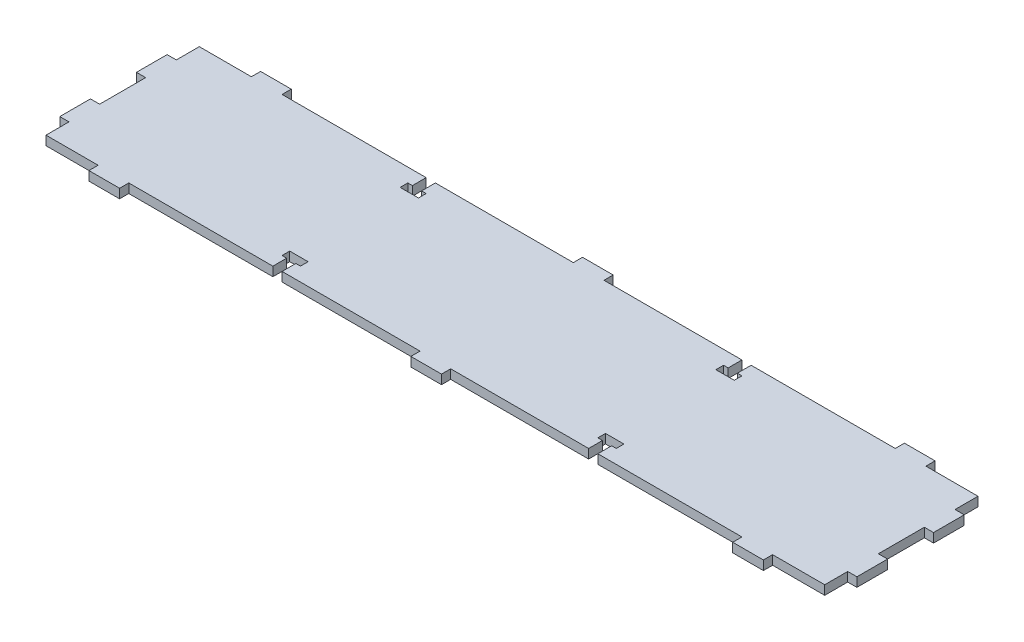
from build123d import *

# Parameters (mm, degrees)
SKETCH2_W           = 260
SKETCH2_H           = 56
BOSS_EXTRUDE1_DEPTH = 3
SKETCH4_W           = 3
SKETCH4_H           = 15
CUT_EXTRUDE1_DEPTH  = 134.015036744


with BuildPart() as part:
    # Sketch2 → Boss-Extrude1 (new body)
    with BuildSketch(Plane(origin=(0, 0, 0), x_dir=(1, 0, 0), z_dir=(0, 1, 0))):
        Rectangle(SKETCH2_W, SKETCH2_H)
    extrude(amount=BOSS_EXTRUDE1_DEPTH)

    # Sketch4 → Cut-Extrude1 (cut, through all)
    with BuildSketch(Plane(origin=(0, 3, 0), x_dir=(1, 0, 0), z_dir=(0, 1, 0))):
        with Locations((-128.5, 0)):
            Rectangle(SKETCH4_W, SKETCH4_H)
        Polygon((-50, 25), (-50, 20.5), (-48.5, 20.5), (-48.5, 18), (-54.5, 18), (-54.5, 20.5), (-53, 20.5), (-53, 25), (-100, 25), (-100, 28), (-5, 28), (-5, 25), align=None)
        Polygon((-130, 28), (-130, 17.5), (-127, 17.5), (-127, 25), (-110, 25), (-110, 28), align=None)
        Polygon((110, 28), (130, 28), (130, 17.5), (127, 17.5), (127, 25), (110, 25), align=None)
        Polygon((5, 28), (5, 25), (50, 25), (50, 20.5), (48.5, 20.5), (48.5, 18), (54.5, 18), (54.5, 20.5), (53, 20.5), (53, 25), (100, 25), (100, 28), align=None)
        with Locations((128.5, 0)):
            Rectangle(SKETCH4_W, SKETCH4_H)
        Polygon((50, -25), (50, -20.5), (48.5, -20.5), (48.5, -18), (54.5, -18), (54.5, -20.5), (53, -20.5), (53, -25), (100, -25), (100, -28), (5, -28), (5, -25), align=None)
        Polygon((130, -28), (130, -17.5), (127, -17.5), (127, -25), (110, -25), (110, -28), align=None)
        Polygon((-110, -28), (-130, -28), (-130, -17.5), (-127, -17.5), (-127, -25), (-110, -25), align=None)
        Polygon((-5, -28), (-5, -25), (-50, -25), (-50, -20.5), (-48.5, -20.5), (-48.5, -18), (-54.5, -18), (-54.5, -20.5), (-53, -20.5), (-53, -25), (-100, -25), (-100, -28), align=None)
    extrude(amount=-CUT_EXTRUDE1_DEPTH, mode=Mode.SUBTRACT)


solid = part.part
